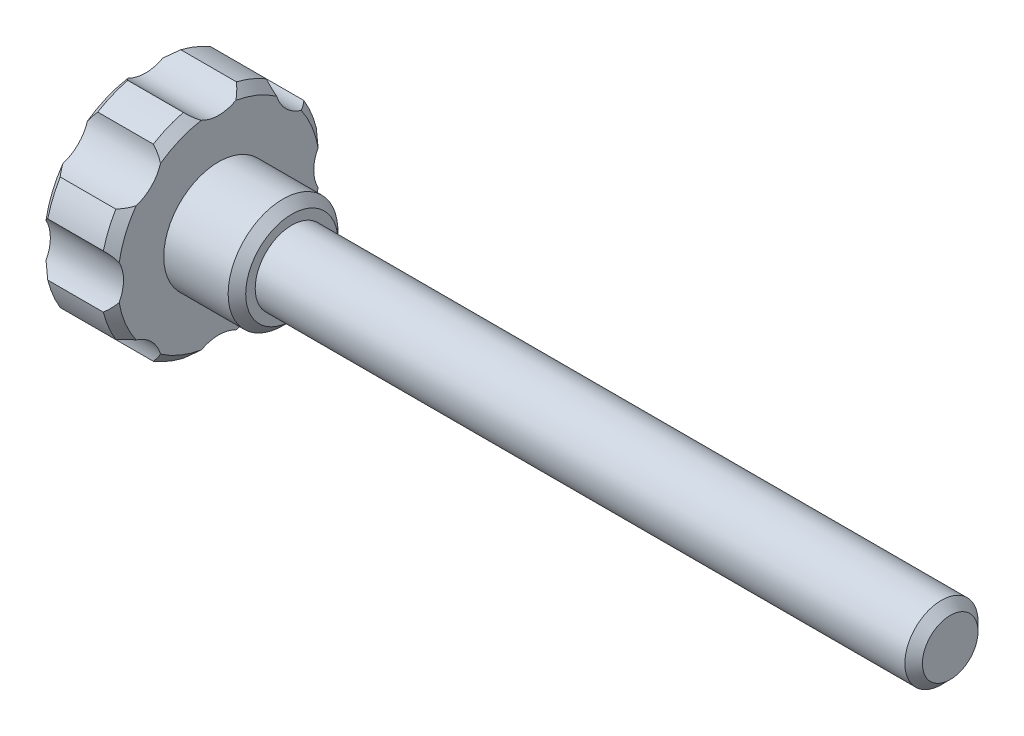
from build123d import *

# Parameters (mm, degrees)
SKETCH1_R           = 3.175
BOSS_EXTRUDE1_DEPTH = 57.15
CHAMFER1_SIZE       = 0.762
SKETCH6_R           = 4.7625
BOSS_EXTRUDE2_DEPTH = 6.35
SKETCH7_R           = 9.525
BOSS_EXTRUDE3_DEPTH = 6.35
CHAMFER2_SIZE       = 0.762
SKETCH8_R           = 3.175
CUT_EXTRUDE1_DEPTH  = 72.137006895
CIRPATTERN1_COUNT   = 8


with BuildPart() as part:
    # Sketch1 → Boss-Extrude1 (new body)
    with BuildSketch(Plane(origin=(0, 0, 0), x_dir=(0, 0, -1), z_dir=(1, 0, 0))):
        Circle(SKETCH1_R)
    extrude(amount=BOSS_EXTRUDE1_DEPTH)

    # Chamfer1
    chamfer1_edges = [part.edges().sort_by_distance(p)[0] for p in [
        (57.15, 0, 3.175),
    ]]
    chamfer(chamfer1_edges, length=CHAMFER1_SIZE)

    # Sketch6 → Boss-Extrude2 (add)
    with BuildSketch(Plane.ZY):
        Circle(SKETCH6_R)
    extrude(amount=BOSS_EXTRUDE2_DEPTH)

    # Sketch7 → Boss-Extrude3 (add)
    with BuildSketch(Plane.ZY.offset(6.35)):
        Circle(SKETCH7_R)
    extrude(amount=BOSS_EXTRUDE3_DEPTH)

    # Chamfer2
    chamfer2_edges = [part.edges().sort_by_distance(p)[0] for p in [
        (-6.35, 0, -9.525),
        (-12.7, 0, -9.525),
        (0, 0, -4.7625),
    ]]
    chamfer(chamfer2_edges, length=CHAMFER2_SIZE)

    # Sketch8 → Cut-Extrude1 (cut, through all)
    with BuildSketch(Plane.ZY.offset(12.7)):
        with Locations((0, 11.43)):
            Circle(SKETCH8_R)
    cut_extrude1 = extrude(amount=-CUT_EXTRUDE1_DEPTH, mode=Mode.SUBTRACT)

    # CirPattern1: Cut-Extrude1 ×8 about axis
    cirpattern1_axis = Axis((0, 0, 0), (1, 0, 0))
    for i in range(1, CIRPATTERN1_COUNT):
        add(cut_extrude1.rotate(cirpattern1_axis, i * 360 / CIRPATTERN1_COUNT), mode=Mode.SUBTRACT)


solid = part.part
